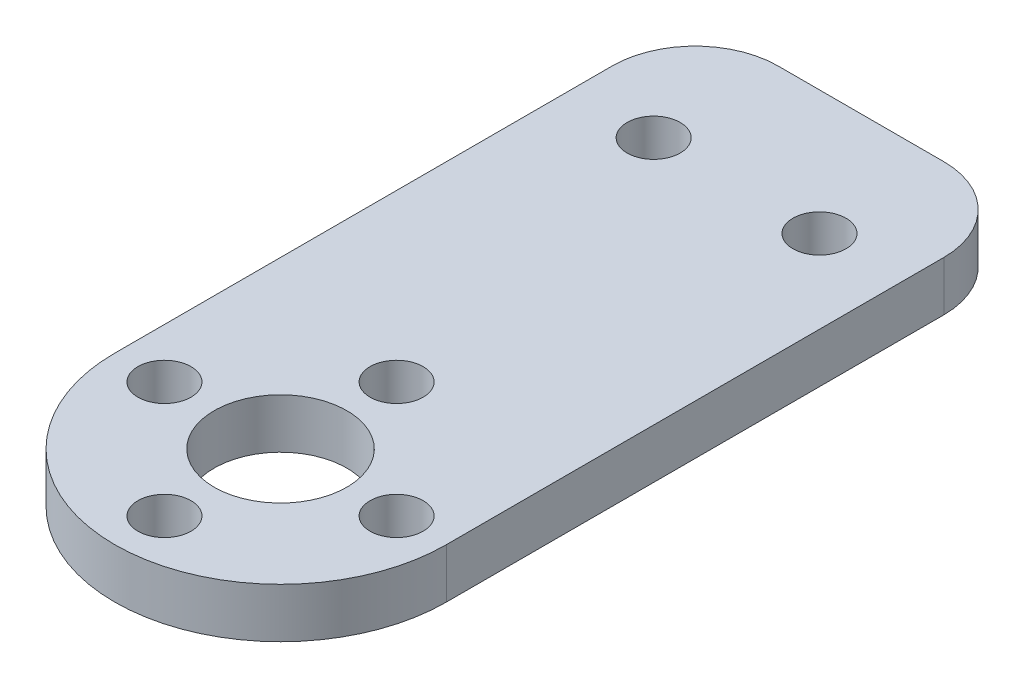
from build123d import *

# Parameters (mm, degrees)
SKETCH_1_R      = 1.6
SKETCH_1_R_2    = 4
EXTRUDE_1_DEPTH = 3
FILLET_1_R      = 5


with BuildPart() as part:
    # 草图1 → 凸台-拉伸1 (new body)
    with BuildSketch(Plane(origin=(0, 0, 0), x_dir=(1, 0, 0), z_dir=(0, 1, 0))):
        with BuildLine():
            Line((-10, 0), (-10, 35))
            Line((-10, 35), (10, 35))
            Line((10, 35), (10, 0))
            ThreePointArc((10, 0), (0, -10), (-10, 0))
        make_face()
        with Locations(Location((-5, 27.5, 0), (0, 0, 270))):
            Circle(SKETCH_1_R, mode=Mode.SUBTRACT)
        with Locations(Location((5, 27.5, 0), (0, 0, 270))):
            Circle(SKETCH_1_R, mode=Mode.SUBTRACT)
        with Locations(Location((0, 7, 0), (0, 0, 270))):
            Circle(SKETCH_1_R, mode=Mode.SUBTRACT)
        with Locations(Location((-7, 0, 0), (0, 0, 270))):
            Circle(SKETCH_1_R, mode=Mode.SUBTRACT)
        with Locations(Location((0, -7, 0), (0, 0, 270))):
            Circle(SKETCH_1_R, mode=Mode.SUBTRACT)
        with Locations(Location((7, 0, 0), (0, 0, 270))):
            Circle(SKETCH_1_R, mode=Mode.SUBTRACT)
        with Locations(Location((0, 0, 0), (0, 0, 270))):
            Circle(SKETCH_1_R_2, mode=Mode.SUBTRACT)
    extrude(amount=EXTRUDE_1_DEPTH)

    # 圆角1
    fillet_1_edges = [part.edges().sort_by_distance(p)[0] for p in [
        (-10, 1.5, -35),
        (10, 1.5, -35),
    ]]
    fillet(fillet_1_edges, radius=FILLET_1_R)


solid = part.part
